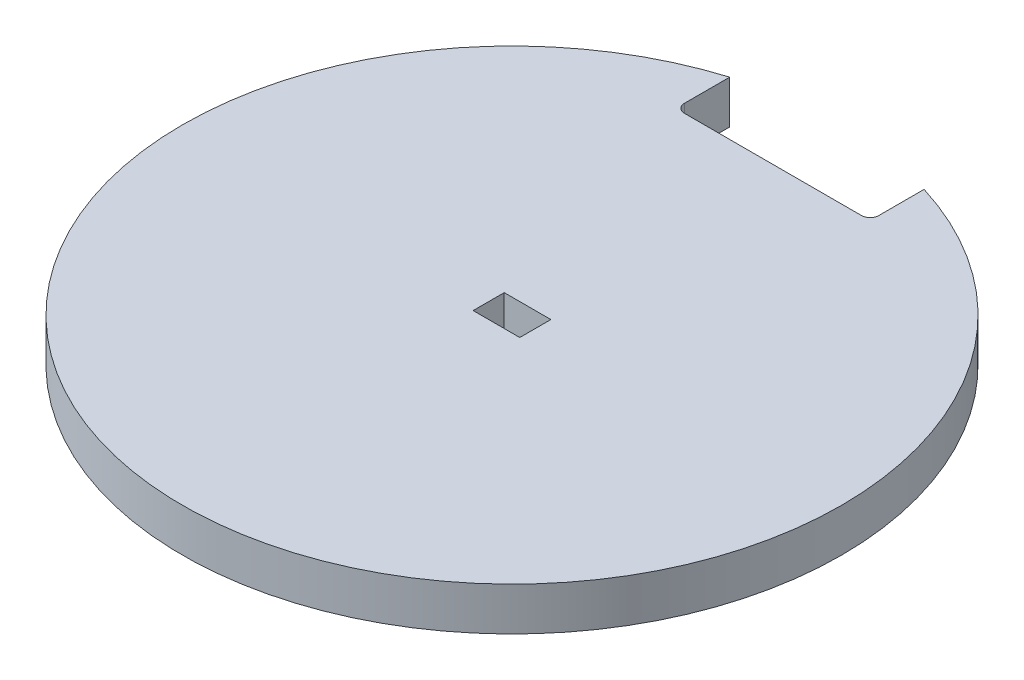
from build123d import *

# Parameters (mm, degrees)
SKETCH1_W           = 5.4
SKETCH1_H           = 3.6
BOSS_EXTRUDE1_DEPTH = 5


with BuildPart() as part:
    # Sketch1 → Boss-Extrude1 (new body)
    with BuildSketch(Plane(origin=(0, 0, 0), x_dir=(1, 0, 0), z_dir=(0, 1, 0))):
        with BuildLine():
            ThreePointArc((34.042513552, 0), (26.590386774, 22.649879577), (7.14560225, 36.450299612))
            Line((7.14560225, 36.450299612), (7.14560225, 31.202638223))
            ThreePointArc((7.14560225, 31.202638223), (6.852709032, 30.495531442), (6.14560225, 30.202638223))
            Line((6.14560225, 30.202638223), (-14.35439775, 30.202638223))
            ThreePointArc((-14.35439775, 30.202638223), (-15.061504531, 30.495531442), (-15.35439775, 31.202638223))
            Line((-15.35439775, 31.202638223), (-15.35439775, 36.450299612))
            ThreePointArc((-15.35439775, 36.450299612), (-26.754277326, -30.694784524), (34.042513552, 0))
        make_face()
        with Locations((-4.10439775, 0)):
            Rectangle(SKETCH1_W, SKETCH1_H, mode=Mode.SUBTRACT)
    extrude(amount=BOSS_EXTRUDE1_DEPTH)


solid = part.part
